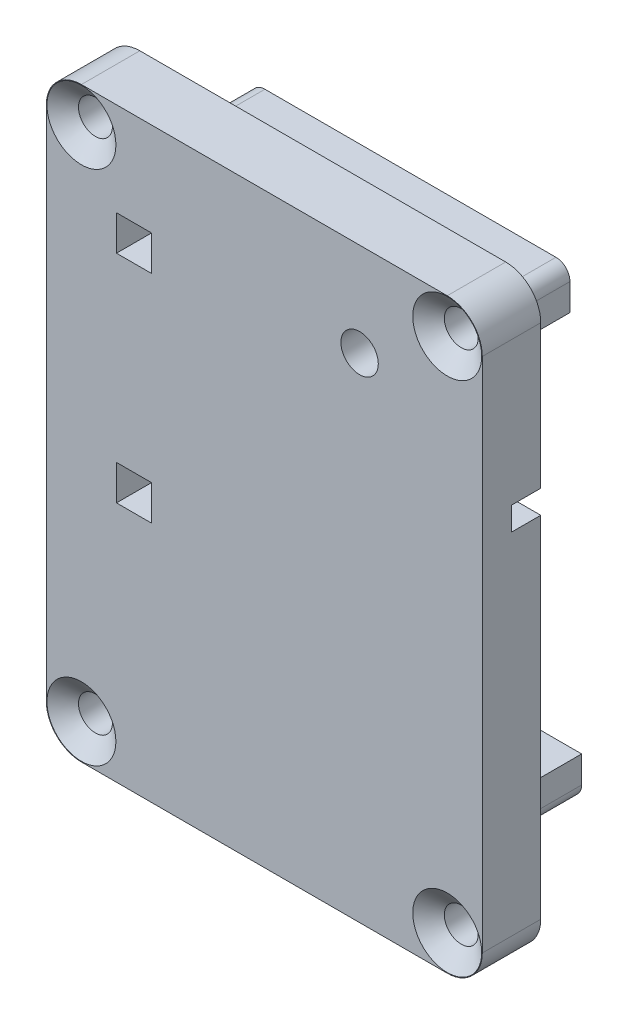
from build123d import *

# Parameters (mm, degrees)
SKETCH_1_W               = 37.3
SKETCH_1_H               = 50.2
EXTRUDE_1_DEPTH          = 5
SKETCH_2_W               = 27.3
SKETCH_2_H               = 3.5
EXTRUDE_2_DEPTH          = 8.5
SKETCH_2_3_W             = 27.3
SKETCH_2_3_H             = 3.5
EXTRUDE_3_DEPTH          = 7.5
FILLET_1_R               = 1.2
FILLET_2_R               = 3
CUT_EXTRUDE_1_DEPTH      = 35.059983852
CUT_EXTRUDE_1_DEPTH_BACK = 35.059983852
SKETCH_4_R               = 1.6
SKETCH_5_W               = 4.5
SKETCH_5_H               = 4.5
CUT_EXTRUDE_2_DEPTH      = 1.5
SKETCH_6_R               = 1.45
CUT_EXTRUDE_3_DEPTH      = 35.059983852
CHAMFER_1_SIZE           = 1.5
CHAMFER_1_SIZE2          = 1.2
SKETCH_8_W               = 3
SKETCH_8_H               = 3
CUT_EXTRUDE_4_DEPTH      = 5
SKETCH_9_W               = 20.033877817
SKETCH_9_H               = 2
CUT_EXTRUDE_5_DEPTH      = 10


with BuildPart() as part:
    # 스케치1 → 보스-돌출1 (new body)
    with BuildSketch(Plane.XY):
        Rectangle(SKETCH_1_W, SKETCH_1_H)
    extrude(amount=EXTRUDE_1_DEPTH)

    # 스케치2 → 보스-돌출2 (add)
    with BuildSketch(Plane.XY):
        with Locations((0, -18.35)):
            Rectangle(SKETCH_2_W, SKETCH_2_H)
    extrude(amount=-EXTRUDE_2_DEPTH)

    # 스케치2<3> → 보스-돌출3 (add)
    with BuildSketch(Plane.XY):
        with Locations((0, 18.35)):
            Rectangle(SKETCH_2_3_W, SKETCH_2_3_H)
    extrude(amount=-EXTRUDE_3_DEPTH)

    # 필렛1
    fillet_1_edges = [part.edges().sort_by_distance(p)[0] for p in [
        (-13.65, -20.1, -4.25),
        (13.65, -20.1, -4.25),
        (13.65, 20.1, -3.75),
        (-13.65, 20.1, -3.75),
    ]]
    fillet(fillet_1_edges, radius=FILLET_1_R)

    # 필렛2
    fillet_2_edges = [part.edges().sort_by_distance(p)[0] for p in [
        (18.65, -25.1, 2.5),
        (-18.65, -25.1, 2.5),
        (-18.65, 25.1, 2.5),
        (18.65, 25.1, 2.5),
    ]]
    fillet(fillet_2_edges, radius=FILLET_2_R)

    # 스케치4 → 컷-돌출1 (cut, two sides: drawn at the far end of the back side and taken through both)
    with BuildSketch(Plane.XY.offset(5).offset(-CUT_EXTRUDE_1_DEPTH_BACK)):
        with Locations((8.15, 17.1)):
            Circle(SKETCH_4_R)
    extrude(amount=CUT_EXTRUDE_1_DEPTH + CUT_EXTRUDE_1_DEPTH_BACK, mode=Mode.SUBTRACT)

    # 스케치5 → 컷-돌출2 (cut)
    with BuildSketch(Plane(origin=(0, 0, -7.5), x_dir=(-1, 0, 0), z_dir=(0, 0, -1))):
        with Locations((-8.15, 17.1)):
            Rectangle(SKETCH_5_W, SKETCH_5_H)
    extrude(amount=-CUT_EXTRUDE_2_DEPTH, mode=Mode.SUBTRACT)

    # 스케치6 → 컷-돌출3 (cut, through all)
    with BuildSketch(Plane.XY.offset(5)):
        with Locations((-15.65, 22.1)):
            Circle(SKETCH_6_R)
        with Locations((15.65, 22.1)):
            Circle(SKETCH_6_R)
        with Locations((15.65, -22.1)):
            Circle(SKETCH_6_R)
        with Locations((-15.65, -22.1)):
            Circle(SKETCH_6_R)
    extrude(amount=-CUT_EXTRUDE_3_DEPTH, mode=Mode.SUBTRACT)

    # 모따기1
    chamfer_1_edges = [part.edges().sort_by_distance(p)[0] for p in [
        (14.2, -22.1, 5),
        (-17.1, -22.1, 5),
        (14.2, 22.1, 5),
        (-17.1, 22.1, 5),
    ]]
    chamfer_1_side = [part.faces().sort_by_distance(p)[0] for p in [
        (-0.035812285, -0.075139887, 5),
    ]]
    chamfer(chamfer_1_edges, length=CHAMFER_1_SIZE, length2=CHAMFER_1_SIZE2, reference=chamfer_1_side[0])

    # 스케치8 → 컷-돌출4 (cut)
    with BuildSketch(Plane.XY.offset(5)):
        with Locations((-11.15, 15.6)):
            Rectangle(SKETCH_8_W, SKETCH_8_H)
        with Locations((-11.15, -2.9)):
            Rectangle(SKETCH_8_W, SKETCH_8_H)
    extrude(amount=-CUT_EXTRUDE_4_DEPTH, mode=Mode.SUBTRACT)

    # 스케치9 → 컷-돌출5 (cut)
    with BuildSketch(Plane(origin=(0, 0, -7.5), x_dir=(-1, 0, 0), z_dir=(0, 0, -1))):
        with Locations((-10.016938909, 8.833508823)):
            Rectangle(SKETCH_9_W, SKETCH_9_H)
    extrude(amount=-CUT_EXTRUDE_5_DEPTH, mode=Mode.SUBTRACT)


solid = part.part
